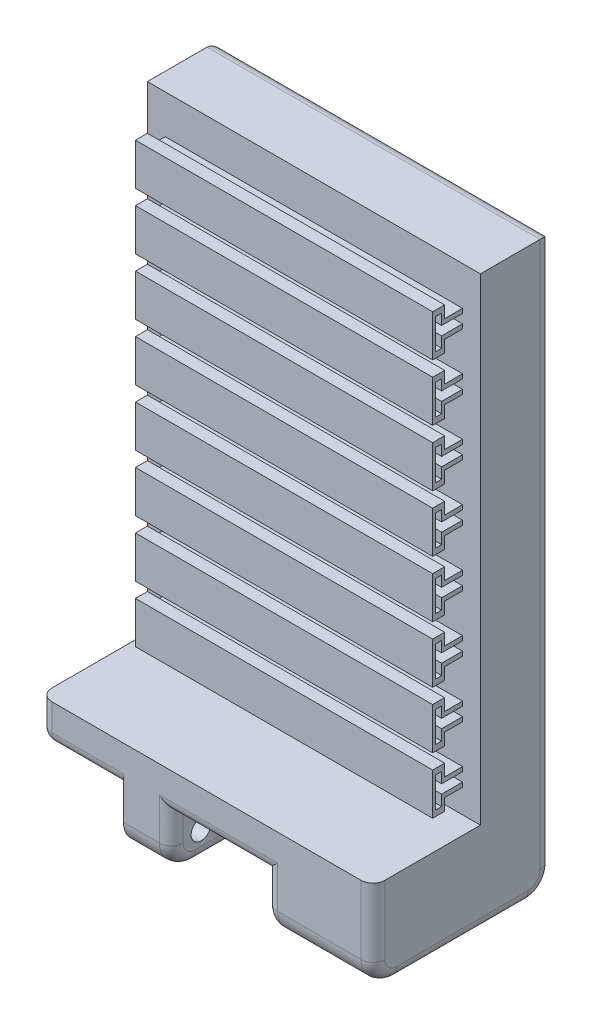
from build123d import *

# Parameters (mm, degrees)
SKETCH1_W              = 55.8
SKETCH1_H              = 30
BOSS_EXTRUDE1_DEPTH    = 6.5
SKETCH2_W              = 8
SKETCH2_H              = 30
SKETCH2_W_2            = 18
BOSS_EXTRUDE2_DEPTH    = 9
CUT_EXTRUDE1_REACH     = 47.313
SKETCH5_W              = 55.8
SKETCH5_H              = 12
BOSS_EXTRUDE3_DEPTH    = 80
BOSS_EXTRUDE5_DEPTH    = 55.8
LPATTERN1_COUNT        = 8
LPATTERN1_PITCH        = 9.5
CUT_EXTRUDE3_DEPTH     = 3
LPATTERN3_COUNT        = 8
LPATTERN3_PITCH        = 9.5
LPATTERN3_COPY_1_DEPTH = 3
LPATTERN3_COPY_2_DEPTH = 3
LPATTERN3_COPY_3_DEPTH = 3
LPATTERN3_COPY_4_DEPTH = 3
LPATTERN3_COPY_5_DEPTH = 3
LPATTERN3_COPY_6_DEPTH = 3
LPATTERN3_COPY_7_DEPTH = 3
CUT_EXTRUDE5_REACH     = 104.446
LPATTERN4_COUNT        = 8
LPATTERN4_PITCH        = 9.5
FILLET1_R              = 4
FILLET8_R              = 4
FILLET9_R              = 2
FILLET12_R             = 2
FILLET13_R             = 2
FILLET15_R             = 2
FILLET16_R             = 2


with BuildPart() as part:
    # Sketch1 → Boss-Extrude1 (new body)
    with BuildSketch(Plane(origin=(0, 0, 0), x_dir=(1, 0, 0), z_dir=(0, 1, 0))):
        Rectangle(SKETCH1_W, SKETCH1_H)
    extrude(amount=BOSS_EXTRUDE1_DEPTH)

    # Sketch2 → Boss-Extrude2 (add)
    with BuildSketch(Plane(origin=(0, 0, 0), x_dir=(-1, 0, 0), z_dir=(0, -1, 0))):
        with Locations((9.9, 0)):
            Rectangle(SKETCH2_W, SKETCH2_H)
        with Locations((-18.9, 0)):
            Rectangle(SKETCH2_W_2, SKETCH2_H)
    extrude(amount=BOSS_EXTRUDE2_DEPTH)

    # Sketch4 → Cut-Extrude1 (cut, up to next)
    with BuildSketch(Plane.ZY.offset(13.9), mode=Mode.PRIVATE) as cut_extrude1_sk1:
        with BuildLine():
            ThreePointArc((-8.325, -4.5), (-10, -2.825), (-11.675, -4.5))
            Line((-11.675, -4.5), (-10, -4.5))
            Line((-10, -4.5), (-8.325, -4.5))
        make_face()
    cut_extrude1_tool1 = extrude(cut_extrude1_sk1.sketch, amount=-CUT_EXTRUDE1_REACH, mode=Mode.PRIVATE) & part.part
    # Sketch4 → Cut-Extrude1 (cut, up to next)
    with BuildSketch(Plane.ZY.offset(13.9), mode=Mode.PRIVATE) as cut_extrude1_sk2:
        with BuildLine():
            Line((-10, -4.5), (-11.675, -4.5))
            ThreePointArc((-11.675, -4.5), (-10, -6.175), (-8.325, -4.5))
            Line((-8.325, -4.5), (-10, -4.5))
        make_face()
    cut_extrude1_tool2 = extrude(cut_extrude1_sk2.sketch, amount=-CUT_EXTRUDE1_REACH, mode=Mode.PRIVATE) & part.part
    # Sketch4 → Cut-Extrude1 (cut, up to next)
    with BuildSketch(Plane.ZY.offset(13.9), mode=Mode.PRIVATE) as cut_extrude1_sk3:
        with BuildLine():
            ThreePointArc((-8.325, -4.5), (-10, -2.825), (-11.675, -4.5))
            Line((-11.675, -4.5), (-10, -4.5))
            Line((-10, -4.5), (-8.325, -4.5))
        make_face()
    cut_extrude1_tool3 = extrude(cut_extrude1_sk3.sketch, amount=-CUT_EXTRUDE1_REACH, mode=Mode.PRIVATE) & part.part
    # Sketch4 → Cut-Extrude1 (cut, up to next)
    with BuildSketch(Plane.ZY.offset(13.9), mode=Mode.PRIVATE) as cut_extrude1_sk4:
        with BuildLine():
            Line((-10, -4.5), (-11.675, -4.5))
            ThreePointArc((-11.675, -4.5), (-10, -6.175), (-8.325, -4.5))
            Line((-8.325, -4.5), (-10, -4.5))
        make_face()
    cut_extrude1_tool4 = extrude(cut_extrude1_sk4.sketch, amount=-CUT_EXTRUDE1_REACH, mode=Mode.PRIVATE) & part.part
    # Sketch4 → Cut-Extrude1 (cut, up to next)
    with BuildSketch(Plane.ZY.offset(13.9), mode=Mode.PRIVATE) as cut_extrude1_sk5:
        with BuildLine():
            ThreePointArc((1.675, -4.5), (0, -2.825), (-1.675, -4.5))
            Line((-1.675, -4.5), (0, -4.5))
            Line((0, -4.5), (1.675, -4.5))
        make_face()
    cut_extrude1_tool5 = extrude(cut_extrude1_sk5.sketch, amount=-CUT_EXTRUDE1_REACH, mode=Mode.PRIVATE) & part.part
    # Sketch4 → Cut-Extrude1 (cut, up to next)
    with BuildSketch(Plane.ZY.offset(13.9), mode=Mode.PRIVATE) as cut_extrude1_sk6:
        with BuildLine():
            Line((0, -4.5), (-1.675, -4.5))
            ThreePointArc((-1.675, -4.5), (0, -6.175), (1.675, -4.5))
            Line((1.675, -4.5), (0, -4.5))
        make_face()
    cut_extrude1_tool6 = extrude(cut_extrude1_sk6.sketch, amount=-CUT_EXTRUDE1_REACH, mode=Mode.PRIVATE) & part.part
    # Sketch4 → Cut-Extrude1 (cut, up to next)
    with BuildSketch(Plane.ZY.offset(13.9), mode=Mode.PRIVATE) as cut_extrude1_sk7:
        with BuildLine():
            ThreePointArc((1.675, -4.5), (0, -2.825), (-1.675, -4.5))
            Line((-1.675, -4.5), (0, -4.5))
            Line((0, -4.5), (1.675, -4.5))
        make_face()
    cut_extrude1_tool7 = extrude(cut_extrude1_sk7.sketch, amount=-CUT_EXTRUDE1_REACH, mode=Mode.PRIVATE) & part.part
    # Sketch4 → Cut-Extrude1 (cut, up to next)
    with BuildSketch(Plane.ZY.offset(13.9), mode=Mode.PRIVATE) as cut_extrude1_sk8:
        with BuildLine():
            Line((0, -4.5), (-1.675, -4.5))
            ThreePointArc((-1.675, -4.5), (0, -6.175), (1.675, -4.5))
            Line((1.675, -4.5), (0, -4.5))
        make_face()
    cut_extrude1_tool8 = extrude(cut_extrude1_sk8.sketch, amount=-CUT_EXTRUDE1_REACH, mode=Mode.PRIVATE) & part.part
    # Sketch4 → Cut-Extrude1 (cut, up to next)
    with BuildSketch(Plane.ZY.offset(13.9), mode=Mode.PRIVATE) as cut_extrude1_sk9:
        with BuildLine():
            ThreePointArc((11.675, -4.5), (10, -2.825), (8.325, -4.5))
            Line((8.325, -4.5), (10, -4.5))
            Line((10, -4.5), (11.675, -4.5))
        make_face()
    cut_extrude1_tool9 = extrude(cut_extrude1_sk9.sketch, amount=-CUT_EXTRUDE1_REACH, mode=Mode.PRIVATE) & part.part
    # Sketch4 → Cut-Extrude1 (cut, up to next)
    with BuildSketch(Plane.ZY.offset(13.9), mode=Mode.PRIVATE) as cut_extrude1_sk10:
        with BuildLine():
            Line((10, -4.5), (8.325, -4.5))
            ThreePointArc((8.325, -4.5), (10, -6.175), (11.675, -4.5))
            Line((11.675, -4.5), (10, -4.5))
        make_face()
    cut_extrude1_tool10 = extrude(cut_extrude1_sk10.sketch, amount=-CUT_EXTRUDE1_REACH, mode=Mode.PRIVATE) & part.part
    # Sketch4 → Cut-Extrude1 (cut, up to next)
    with BuildSketch(Plane.ZY.offset(13.9), mode=Mode.PRIVATE) as cut_extrude1_sk11:
        with BuildLine():
            ThreePointArc((11.675, -4.5), (10, -2.825), (8.325, -4.5))
            Line((8.325, -4.5), (10, -4.5))
            Line((10, -4.5), (11.675, -4.5))
        make_face()
    cut_extrude1_tool11 = extrude(cut_extrude1_sk11.sketch, amount=-CUT_EXTRUDE1_REACH, mode=Mode.PRIVATE) & part.part
    # Sketch4 → Cut-Extrude1 (cut, up to next)
    with BuildSketch(Plane.ZY.offset(13.9), mode=Mode.PRIVATE) as cut_extrude1_sk12:
        with BuildLine():
            Line((10, -4.5), (8.325, -4.5))
            ThreePointArc((8.325, -4.5), (10, -6.175), (11.675, -4.5))
            Line((11.675, -4.5), (10, -4.5))
        make_face()
    cut_extrude1_tool12 = extrude(cut_extrude1_sk12.sketch, amount=-CUT_EXTRUDE1_REACH, mode=Mode.PRIVATE) & part.part
    add(cut_extrude1_tool1.solids().sort_by_distance((-13.9, -3.789108, -10))[0], mode=Mode.SUBTRACT)
    add(cut_extrude1_tool2.solids().sort_by_distance((-13.9, -5.210892, -10))[0], mode=Mode.SUBTRACT)
    add(cut_extrude1_tool3.solids().sort_by_distance((-13.9, -3.789108, -10))[0], mode=Mode.SUBTRACT)
    add(cut_extrude1_tool4.solids().sort_by_distance((-13.9, -5.210892, -10))[0], mode=Mode.SUBTRACT)
    add(cut_extrude1_tool5.solids().sort_by_distance((-13.9, -3.789108, 0))[0], mode=Mode.SUBTRACT)
    add(cut_extrude1_tool6.solids().sort_by_distance((-13.9, -5.210892, 0))[0], mode=Mode.SUBTRACT)
    add(cut_extrude1_tool7.solids().sort_by_distance((-13.9, -3.789108, 0))[0], mode=Mode.SUBTRACT)
    add(cut_extrude1_tool8.solids().sort_by_distance((-13.9, -5.210892, 0))[0], mode=Mode.SUBTRACT)
    add(cut_extrude1_tool9.solids().sort_by_distance((-13.9, -3.789108, 10))[0], mode=Mode.SUBTRACT)
    add(cut_extrude1_tool10.solids().sort_by_distance((-13.9, -5.210892, 10))[0], mode=Mode.SUBTRACT)
    add(cut_extrude1_tool11.solids().sort_by_distance((-13.9, -3.789108, 10))[0], mode=Mode.SUBTRACT)
    add(cut_extrude1_tool12.solids().sort_by_distance((-13.9, -5.210892, 10))[0], mode=Mode.SUBTRACT)

    # Sketch5 → Boss-Extrude3 (add)
    with BuildSketch(Plane(origin=(0, 6.5, 0), x_dir=(1, 0, 0), z_dir=(0, 1, 0))):
        with Locations((0, 9)):
            Rectangle(SKETCH5_W, SKETCH5_H)
    extrude(amount=BOSS_EXTRUDE3_DEPTH)

    # Sketch7 → Boss-Extrude5 (add, through all)
    with BuildSketch(Plane.ZY.offset(27.9)):
        Polygon((0, 80), (-3, 80), (-3, 77), (0, 77), (0, 75), (2, 75), (2, 82), (0, 82), align=None)
    boss_extrude5 = extrude(amount=-BOSS_EXTRUDE5_DEPTH)

    # LPattern1: Boss-Extrude5 ×8
    with Locations(*[(0, -i * LPATTERN1_PITCH, 0) for i in range(1, LPATTERN1_COUNT)]):
        add(boss_extrude5)

    # Sketch15 → Cut-Extrude3 (cut)
    with BuildSketch(Plane(origin=(27.9, 0, 0), x_dir=(0, 0, -1), z_dir=(1, 0, 0))):
        Polygon((3, 80), (0, 80), (0, 82), (-2, 82), (-2, 75), (0, 75), (0, 77), (3, 77), align=None)
    cut_extrude3 = extrude(amount=-CUT_EXTRUDE3_DEPTH, mode=Mode.SUBTRACT)

    # Mirror1: Cut-Extrude3 across plane
    add(cut_extrude3.mirror(Plane(origin=(0, 0, 0), x_dir=(0, 0, 1), z_dir=(1, 0, 0))), mode=Mode.SUBTRACT)

    # LPattern3: Cut-Extrude3 ×8
    with Locations(*[(0, -i * LPATTERN3_PITCH, 0) for i in range(1, LPATTERN3_COUNT)]):
        add(cut_extrude3, mode=Mode.SUBTRACT)

    # LPattern3 copy 1 sketch → LPattern3 copy 1 (cut)
    with BuildSketch(Plane(origin=(-27.9, -9.5, 0), x_dir=(0, 0, -1), z_dir=(-1, 0, 0))):
        Polygon((3, -80), (0, -80), (0, -82), (-2, -82), (-2, -75), (0, -75), (0, -77), (3, -77), align=None)
    extrude(amount=-LPATTERN3_COPY_1_DEPTH, mode=Mode.SUBTRACT)

    # LPattern3 copy 2 sketch → LPattern3 copy 2 (cut)
    with BuildSketch(Plane(origin=(-27.9, -19, 0), x_dir=(0, 0, -1), z_dir=(-1, 0, 0))):
        Polygon((3, -80), (0, -80), (0, -82), (-2, -82), (-2, -75), (0, -75), (0, -77), (3, -77), align=None)
    extrude(amount=-LPATTERN3_COPY_2_DEPTH, mode=Mode.SUBTRACT)

    # LPattern3 copy 3 sketch → LPattern3 copy 3 (cut)
    with BuildSketch(Plane(origin=(-27.9, -28.5, 0), x_dir=(0, 0, -1), z_dir=(-1, 0, 0))):
        Polygon((3, -80), (0, -80), (0, -82), (-2, -82), (-2, -75), (0, -75), (0, -77), (3, -77), align=None)
    extrude(amount=-LPATTERN3_COPY_3_DEPTH, mode=Mode.SUBTRACT)

    # LPattern3 copy 4 sketch → LPattern3 copy 4 (cut)
    with BuildSketch(Plane(origin=(-27.9, -38, 0), x_dir=(0, 0, -1), z_dir=(-1, 0, 0))):
        Polygon((3, -80), (0, -80), (0, -82), (-2, -82), (-2, -75), (0, -75), (0, -77), (3, -77), align=None)
    extrude(amount=-LPATTERN3_COPY_4_DEPTH, mode=Mode.SUBTRACT)

    # LPattern3 copy 5 sketch → LPattern3 copy 5 (cut)
    with BuildSketch(Plane(origin=(-27.9, -47.5, 0), x_dir=(0, 0, -1), z_dir=(-1, 0, 0))):
        Polygon((3, -80), (0, -80), (0, -82), (-2, -82), (-2, -75), (0, -75), (0, -77), (3, -77), align=None)
    extrude(amount=-LPATTERN3_COPY_5_DEPTH, mode=Mode.SUBTRACT)

    # LPattern3 copy 6 sketch → LPattern3 copy 6 (cut)
    with BuildSketch(Plane(origin=(-27.9, -57, 0), x_dir=(0, 0, -1), z_dir=(-1, 0, 0))):
        Polygon((3, -80), (0, -80), (0, -82), (-2, -82), (-2, -75), (0, -75), (0, -77), (3, -77), align=None)
    extrude(amount=-LPATTERN3_COPY_6_DEPTH, mode=Mode.SUBTRACT)

    # LPattern3 copy 7 sketch → LPattern3 copy 7 (cut)
    with BuildSketch(Plane(origin=(-27.9, -66.5, 0), x_dir=(0, 0, -1), z_dir=(-1, 0, 0))):
        Polygon((3, -80), (0, -80), (0, -82), (-2, -82), (-2, -75), (0, -75), (0, -77), (3, -77), align=None)
    extrude(amount=-LPATTERN3_COPY_7_DEPTH, mode=Mode.SUBTRACT)

    # Sketch17 → Cut-Extrude5 (cut, up to next)
    with BuildSketch(Plane(origin=(24.9, 0, 0), x_dir=(0, 0, -1), z_dir=(1, 0, 0)), mode=Mode.PRIVATE) as cut_extrude5_sk1:
        Polygon((3, 78.5), (3, 77.75), (0, 77.75), (-0.5, 77.75), (-0.5, 75.95), (-1.5, 75.95), (-1.5, 78.5), (-1.5, 79.25), (-1.5, 81.05), (-0.5, 81.05), (-0.5, 79.25), (3, 79.25), align=None)
    cut_extrude5_tool1 = extrude(cut_extrude5_sk1.sketch, amount=-CUT_EXTRUDE5_REACH, mode=Mode.PRIVATE) & part.part
    cut_extrude5 = cut_extrude5_tool1.solids().sort_by_distance((24.9, 78.5, -0.141304))[0]
    add(cut_extrude5, mode=Mode.SUBTRACT)

    # LPattern4: Cut-Extrude5 ×8
    with Locations(*[(0, -i * LPATTERN4_PITCH, 0) for i in range(1, LPATTERN4_COUNT)]):
        add(cut_extrude5, mode=Mode.SUBTRACT)

    # Fillet1
    fillet1_edges = [part.edges().sort_by_distance(p)[0] for p in [
        (-9.9, -9, 15),
    ]]
    fillet(fillet1_edges, radius=FILLET1_R)

    # Fillet8
    fillet8_edges = [part.edges().sort_by_distance(p)[0] for p in [
        (-9.9, -9, -15),
        (18.9, -9, -15),
        (18.9, -9, 15),
    ]]
    fillet(fillet8_edges, radius=FILLET8_R)

    # Fillet9
    fillet9_edges = [part.edges().sort_by_distance(p)[0] for p in [
        (0, 86.5, -15),
        (-27.9, 43.25, -15),
        (27.9, 0.75, 15),
        (27.9, 40.75, -15),
        (27.9, -9, 0),
        (27.9, -7.828427125, -13.828427125),
        (27.9, -7.828427125, 13.828427125),
    ]]
    fillet(fillet9_edges, radius=FILLET9_R)

    # Fillet12
    fillet12_edges = [part.edges().sort_by_distance(p)[0] for p in [
        (2, 0, -15),
        (-19.9, 0, -15),
        (-27.9, 0, 1),
        (-27.314213562, 0, -14.414213562),
    ]]
    fillet(fillet12_edges, radius=FILLET12_R)

    # Fillet13
    fillet13_edges = [part.edges().sort_by_distance(p)[0] for p in [
        (2, 0, 15),
        (-27.9, 4.25, 15),
        (-19.9, 0, 15),
        (-27.314213562, 0.585786438, 15),
    ]]
    fillet(fillet13_edges, radius=FILLET13_R)

    # Fillet15
    fillet15_edges = [part.edges().sort_by_distance(p)[0] for p in [
        (-5.9, -1.5, -15),
        (-5.9, -7.828427125, -13.828427125),
        (-5.9, -1.5, 15),
        (-5.9, -7.828427125, 13.828427125),
        (-5.9, -9, 0),
    ]]
    fillet(fillet15_edges, radius=FILLET15_R)

    # Fillet16
    fillet16_edges = [part.edges().sort_by_distance(p)[0] for p in [
        (9.9, -1.5, -15),
        (9.9, -7.828427125, -13.828427125),
        (9.9, -1.5, 15),
        (9.9, -7.828427125, 13.828427125),
        (9.9, -9, 0),
    ]]
    fillet(fillet16_edges, radius=FILLET16_R)


solid = part.part
